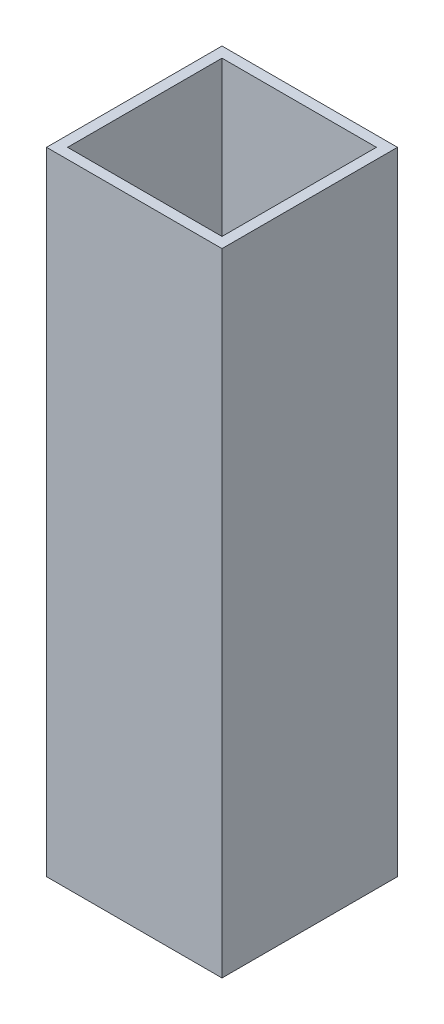
from build123d import *

# Parameters (mm, degrees)
SKETCH1_W           = 12.5
SKETCH1_H           = 12.5
BOSS_EXTRUDE1_DEPTH = 45
SKETCH2_W           = 11
SKETCH2_H           = 11
CUT_EXTRUDE2_DEPTH  = 44


with BuildPart() as part:
    # Sketch1 → Boss-Extrude1 (new body)
    with BuildSketch(Plane(origin=(0, 0, 0), x_dir=(1, 0, 0), z_dir=(0, 1, 0))):
        with Locations((-14.758403361, -3.151260504)):
            Rectangle(SKETCH1_W, SKETCH1_H)
    extrude(amount=BOSS_EXTRUDE1_DEPTH)

    # Sketch2 → Cut-Extrude2 (cut)
    with BuildSketch(Plane(origin=(0, 45, 0), x_dir=(1, 0, 0), z_dir=(0, 1, 0))):
        with Locations((-14.758403361, -3.151260504)):
            Rectangle(SKETCH2_W, SKETCH2_H)
    extrude(amount=-CUT_EXTRUDE2_DEPTH, mode=Mode.SUBTRACT)


solid = part.part
